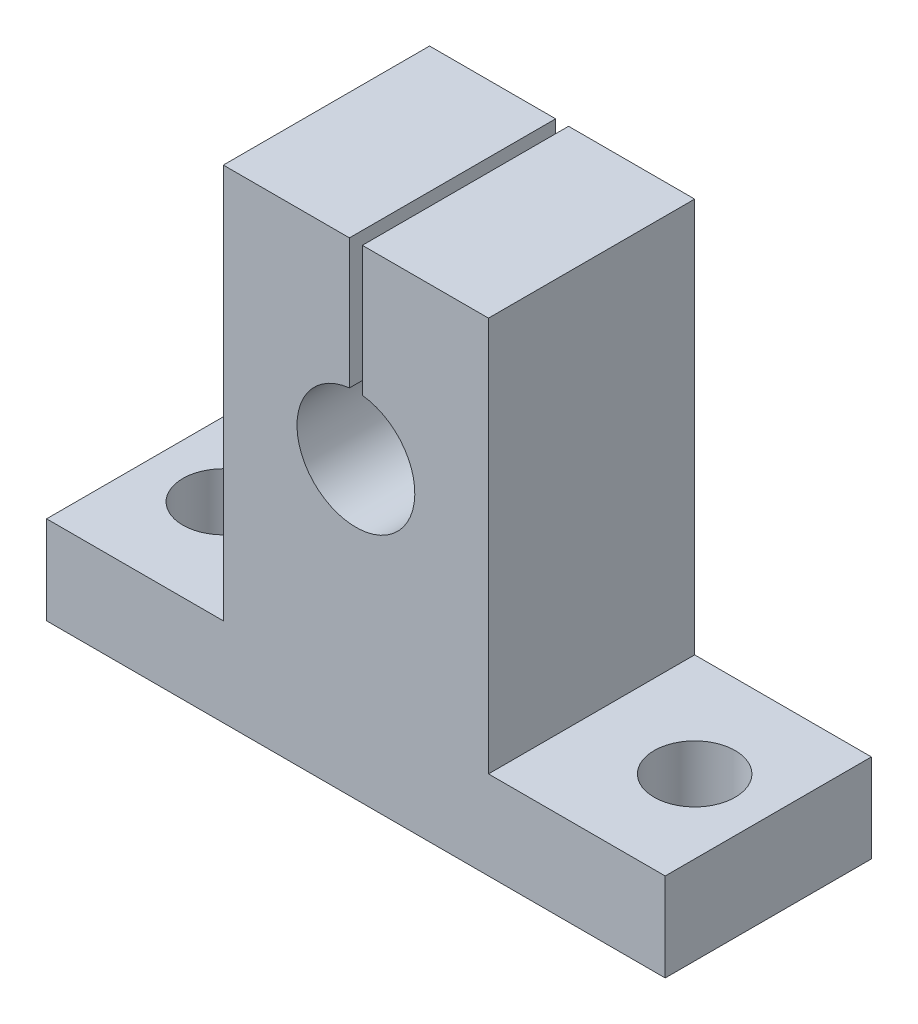
from build123d import *

# Parameters (mm, degrees)
EXTRUDE_2_DEPTH     = 14
SKETCH_2_R          = 2.75
CUT_EXTRUDE_1_DEPTH = 37.813584449


with BuildPart() as part:
    # 草图1 → 凸台-拉伸2 (new body)
    with BuildSketch(Plane.XY):
        with BuildLine():
            Line((21, -20), (-21, -20))
            Line((-21, -20), (-21, -14))
            Line((-21, -14), (-9, -14))
            Line((-9, -14), (-9, 12.8))
            Line((-9, 12.8), (-0.438791817, 12.8))
            Line((-0.438791817, 12.8), (-0.438791817, 3.975859874))
            ThreePointArc((-0.438791817, 3.975859874), (0, -4), (0.438791817, 3.975859874))
            Line((0.438791817, 3.975859874), (0.438791817, 12.8))
            Line((0.438791817, 12.8), (9, 12.8))
            Line((9, 12.8), (9, -14))
            Line((9, -14), (21, -14))
            Line((21, -14), (21, -20))
        make_face()
    extrude(amount=EXTRUDE_2_DEPTH)

    # 草图2 → 切除-拉伸1 (cut, through all)
    with BuildSketch(Plane(origin=(0, -14, 0), x_dir=(1, 0, 0), z_dir=(0, 1, 0))):
        with Locations(Location((-16, -7, 0), (0, 0, 270))):
            Circle(SKETCH_2_R)
        with Locations(Location((16, -7, 0), (0, 0, 270))):
            Circle(SKETCH_2_R)
    extrude(amount=-CUT_EXTRUDE_1_DEPTH, mode=Mode.SUBTRACT)


solid = part.part
